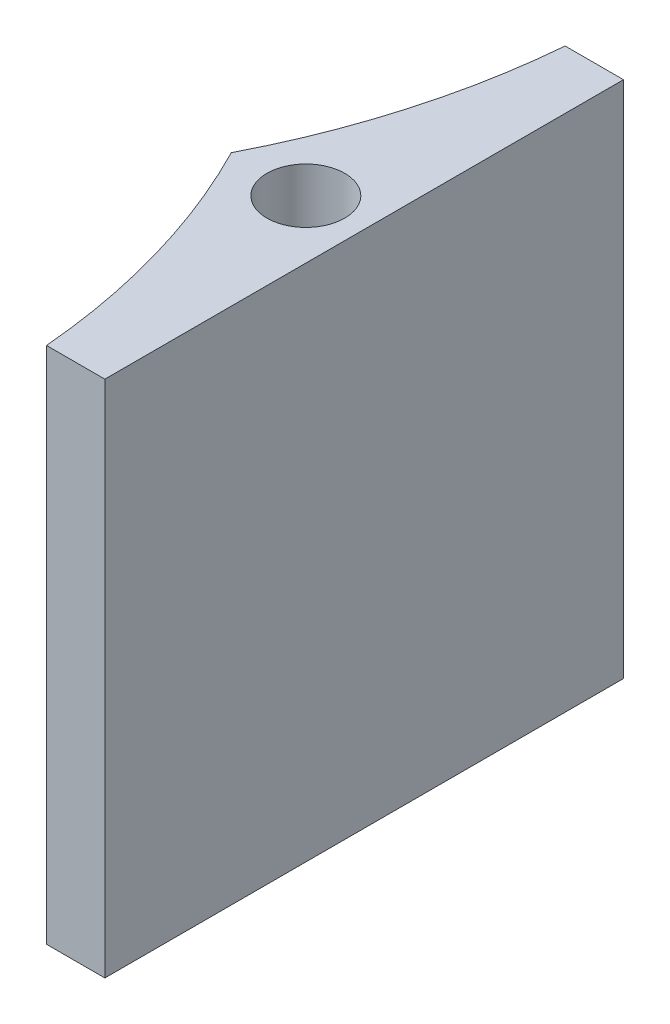
from build123d import *

# Parameters (mm, degrees)
SKETCH1_R           = 3
BOSS_EXTRUDE1_DEPTH = 40


with BuildPart() as part:
    # Sketch1 → Boss-Extrude1 (new body)
    with BuildSketch(Plane(origin=(0, 0, 0), x_dir=(1, 0, 0), z_dir=(0, 1, 0))):
        with BuildLine():
            Line((0, 20), (4.5, 20))
            Line((4.5, 20), (4.5, -20))
            Line((4.5, -20), (0, -20))
            ThreePointArc((0, -20), (-1.898782269, -9.719444247), (-5.749445099, 0))
            ThreePointArc((-5.749445099, 0), (-1.898782269, 9.719444247), (0, 20))
        make_face()
        with Locations(Location((0, 0, 0), (0, 0, 270))):
            Circle(SKETCH1_R, mode=Mode.SUBTRACT)
    extrude(amount=BOSS_EXTRUDE1_DEPTH)


solid = part.part
